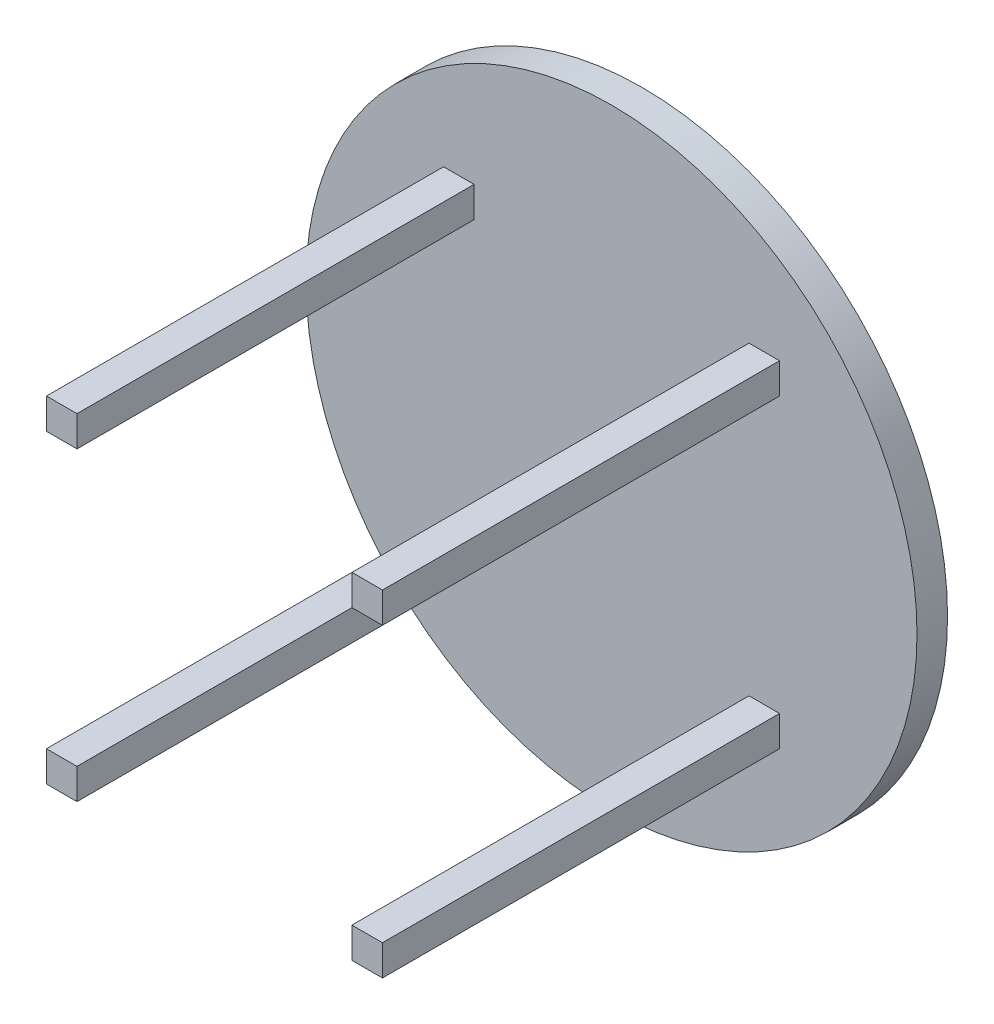
from build123d import *

# Parameters (mm, degrees)
SKETCH_1_R          = 500
EXTRUDE_1_DEPTH     = 50
SKETCH_2_W          = 50
SKETCH_2_H          = 50
EXTRUDE_2_DEPTH     = 700
SKETCH_3_W          = 50
SKETCH_3_H          = 50
EXTRUDE_3_DEPTH     = 700
SKETCH_4_W          = 50
SKETCH_4_H          = 50
EXTRUDE_4_DEPTH     = 700
SKETCH_5_W          = 50
SKETCH_5_H          = 50
EXTRUDE_5_DEPTH     = 700
SKETCH_6_W          = 200
SKETCH_6_H          = 100
EXTRUDE_6_DEPTH     = 50
SKETCH_7_W          = 150
SKETCH_7_H          = 50
CUT_EXTRUDE_1_DEPTH = 30


with BuildPart() as part:
    # 草图1 → 凸台-拉伸1 (new body)
    with BuildSketch(Plane.XY):
        Circle(SKETCH_1_R)
    extrude(amount=EXTRUDE_1_DEPTH)

    # 草图2 → 凸台-拉伸2 (add)
    with BuildSketch(Plane.XY):
        with Locations((250, 250)):
            Rectangle(SKETCH_2_W, SKETCH_2_H)
    extrude(amount=EXTRUDE_2_DEPTH)

    # 草图3 → 凸台-拉伸3 (add)
    with BuildSketch(Plane.XY):
        with Locations((-250, 250)):
            Rectangle(SKETCH_3_W, SKETCH_3_H)
    extrude(amount=EXTRUDE_3_DEPTH)

    # 草图4 → 凸台-拉伸4 (add)
    with BuildSketch(Plane.XY):
        with Locations((250, -250)):
            Rectangle(SKETCH_4_W, SKETCH_4_H)
    extrude(amount=EXTRUDE_4_DEPTH)

    # 草图5 → 凸台-拉伸5 (add)
    with BuildSketch(Plane.XY):
        with Locations((-250, -250)):
            Rectangle(SKETCH_5_W, SKETCH_5_H)
    extrude(amount=EXTRUDE_5_DEPTH)

    # 草图6 → 凸台-拉伸6 (add)
    with BuildSketch(Plane(origin=(0, 275, 0), x_dir=(1, 0, 0), z_dir=(0, 1, 0))):
        Rectangle(SKETCH_6_W, SKETCH_6_H)
    extrude(amount=EXTRUDE_6_DEPTH)

    # 草图7 → 切除-拉伸1 (cut)
    with BuildSketch(Plane(origin=(0, 275, 0), x_dir=(1, 0, 0), z_dir=(0, 1, 0))):
        Rectangle(SKETCH_7_W, SKETCH_7_H)
    extrude(amount=CUT_EXTRUDE_1_DEPTH, mode=Mode.SUBTRACT)


solid = part.part
